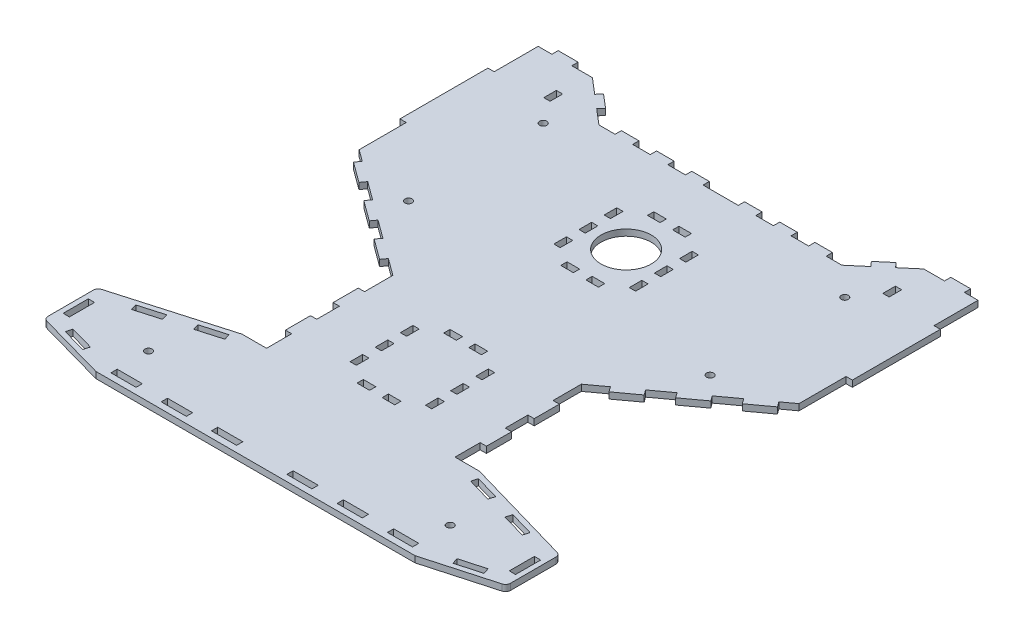
from build123d import *

# Parameters (mm, degrees)
SKETCH1_W           = 2.5
SKETCH1_H           = 10
SKETCH1_W_2         = 10
SKETCH1_H_2         = 2.5
SKETCH1_R           = 1.425
SKETCH1_H_3         = 5
SKETCH1_W_3         = 5
SKETCH1_R_2         = 10
BOSS_EXTRUDE1_DEPTH = 2.5
FILLET2_R           = 2


with BuildPart() as part:
    # Sketch1 → Boss-Extrude1 (new body)
    with BuildSketch(Plane(origin=(0, 0, 0), x_dir=(1, 0, 0), z_dir=(0, 1, 0))):
        Polygon((42.099999999, 82.5), (42.099999999, 85), (35.099999999, 85), (35.099999999, 82.5), (28.099999999, 82.5), (28.099999999, 85), (21.099999999, 85), (21.099999999, 82.5), (14.099999999, 82.5), (14.099999999, 85), (7.099999999, 85), (7.099999999, 82.5), (-6.900000001, 82.5), (-6.900000001, 85), (-13.900000001, 85), (-13.900000001, 82.5), (-20.900000001, 82.5), (-20.900000001, 85), (-27.900000001, 85), (-27.900000001, 82.5), (-34.900000001, 82.5), (-34.900000001, 85), (-41.900000001, 85), (-41.900000001, 82.5), (-48.324658201, 82.5), (-54.391540811, 87.6717252), (-52.769713286, 89.574269675), (-58.096837816, 94.115386744), (-59.718665341, 92.212842269), (-65.92096033, 97.5), (-74.117282979, 97.5), (-74.117282979, 100), (-82.04, 100), (-82.04, 97.5), (-87.5, 97.5), (-87.5, 80), (-90, 80), (-90, 45), (-87.5, 45), (-87.5, 26.268605469), (-82.872162523, 22.882820213), (-84.348313336, 20.865153546), (-76.277646669, 14.960550296), (-74.801495856, 16.978216962), (-67.558072522, 11.678835545), (-69.034223335, 9.661168878), (-60.963556668, 3.756565627), (-59.487405855, 5.774232294), (-52.243982521, 0.474850877), (-53.720133334, -1.54281579), (-45.649466667, -7.447419041), (-44.173315854, -5.429752374), (-37.5, -10.312035847), (-37.5, -21.580641316), (-40, -21.580641316), (-40, -31.580641316), (-37.5, -31.580641316), (-37.5, -40.580641316), (-40, -40.580641316), (-40, -50.580641316), (-37.5, -50.580641316), (-37.5, -60.580641316), (-47.21774937, -60.580641316), (-92, -73.495268006), (-92, -94.516920798), (-63.489002849, -102.5), (63.489002849, -102.5), (92, -94.516920798), (92, -73.495268006), (47.21774937, -60.580641316), (37.5, -60.580641316), (37.5, -50.580641316), (40, -50.580641316), (40, -40.580641316), (37.5, -40.580641316), (37.5, -31.580641316), (40, -31.580641316), (40, -21.580641316), (37.5, -21.580641316), (37.5, -10.312035847), (44.173315854, -5.429752374), (45.649466667, -7.447419041), (53.720133334, -1.54281579), (52.243982521, 0.474850877), (59.487405855, 5.774232294), (60.963556668, 3.756565627), (69.034223335, 9.661168878), (67.558072522, 11.678835545), (74.801495856, 16.978216962), (76.277646669, 14.960550296), (84.348313336, 20.865153546), (82.872162523, 22.882820213), (87.5, 26.268605469), (87.5, 45), (90, 45), (90, 80), (87.5, 80), (87.5, 97.5), (82.1, 97.5), (82.1, 100), (74.177282979, 100), (74.177282979, 97.5), (65.92096033, 97.5), (59.855648543, 92.329613851), (58.233821018, 94.232158326), (52.906696488, 89.691041257), (54.528524013, 87.788496782), (48.324658201, 82.5), align=None)
        Polygon((-72.955536851, -95.176298685), (-73.629611665, -97.583708734), (-83.259251862, -94.887409479), (-82.585177048, -92.479999429), align=None, mode=Mode.SUBTRACT)
        with Locations((-88.75, -84)):
            Rectangle(SKETCH1_W, SKETCH1_H, mode=Mode.SUBTRACT)
        with Locations((-55, -98.75)):
            Rectangle(SKETCH1_W_2, SKETCH1_H_2, mode=Mode.SUBTRACT)
        with Locations(Location((-60, -85, 0), (0, 0, 270))):
            Circle(SKETCH1_R, mode=Mode.SUBTRACT)
        Polygon((-68.82527851, -68.893481916), (-68.132541793, -71.295588459), (-77.740967963, -74.066535325), (-78.43370468, -71.664428783), align=None, mode=Mode.SUBTRACT)
        Polygon((-58.524115623, -68.524641592), (-59.21685234, -66.122535049), (-49.60842617, -63.351588183), (-48.915689453, -65.753694725), align=None, mode=Mode.SUBTRACT)
        with Locations((-35, -98.75)):
            Rectangle(SKETCH1_W_2, SKETCH1_H_2, mode=Mode.SUBTRACT)
        with Locations((-15, -98.75)):
            Rectangle(SKETCH1_W_2, SKETCH1_H_2, mode=Mode.SUBTRACT)
        with Locations((-15, -46.080641316)):
            Rectangle(SKETCH1_W, SKETCH1_H_3, mode=Mode.SUBTRACT)
        with Locations((-5, -53.330641316)):
            Rectangle(SKETCH1_W_3, SKETCH1_H_2, mode=Mode.SUBTRACT)
        with Locations((-15, -36.080641316)):
            Rectangle(SKETCH1_W, SKETCH1_H_3, mode=Mode.SUBTRACT)
        with Locations((-15, -26.080641316)):
            Rectangle(SKETCH1_W, SKETCH1_H_3, mode=Mode.SUBTRACT)
        with Locations((-5, -18.830641316)):
            Rectangle(SKETCH1_W_3, SKETCH1_H_2, mode=Mode.SUBTRACT)
        with Locations((15, -98.75)):
            Rectangle(SKETCH1_W_2, SKETCH1_H_2, mode=Mode.SUBTRACT)
        with Locations((35, -98.75)):
            Rectangle(SKETCH1_W_2, SKETCH1_H_2, mode=Mode.SUBTRACT)
        with Locations((55, -98.75)):
            Rectangle(SKETCH1_W_2, SKETCH1_H_2, mode=Mode.SUBTRACT)
        with Locations(Location((60, -85, 0), (0, 0, 270))):
            Circle(SKETCH1_R, mode=Mode.SUBTRACT)
        Polygon((73.629611665, -97.583708734), (72.955536851, -95.176298685), (82.585177048, -92.479999429), (83.259251862, -94.887409479), align=None, mode=Mode.SUBTRACT)
        with Locations((88.75, -84)):
            Rectangle(SKETCH1_W, SKETCH1_H, mode=Mode.SUBTRACT)
        Polygon((48.915689453, -65.753694725), (49.60842617, -63.351588183), (59.21685234, -66.122535049), (58.524115623, -68.524641592), align=None, mode=Mode.SUBTRACT)
        Polygon((68.132541793, -71.295588459), (68.82527851, -68.893481916), (78.43370468, -71.664428783), (77.740967963, -74.066535325), align=None, mode=Mode.SUBTRACT)
        with Locations((5, -53.330641316)):
            Rectangle(SKETCH1_W_3, SKETCH1_H_2, mode=Mode.SUBTRACT)
        with Locations((15, -46.080641316)):
            Rectangle(SKETCH1_W, SKETCH1_H_3, mode=Mode.SUBTRACT)
        with Locations((15, -36.080641316)):
            Rectangle(SKETCH1_W, SKETCH1_H_3, mode=Mode.SUBTRACT)
        with Locations((5, -18.830641316)):
            Rectangle(SKETCH1_W_3, SKETCH1_H_2, mode=Mode.SUBTRACT)
        with Locations((15, -26.080641316)):
            Rectangle(SKETCH1_W, SKETCH1_H_3, mode=Mode.SUBTRACT)
        with Locations(Location((-60, 18.419358684, 0), (0, 0, 270))):
            Circle(SKETCH1_R, mode=Mode.SUBTRACT)
        with Locations((-5, 27.75)):
            Rectangle(SKETCH1_W_3, SKETCH1_H_2, mode=Mode.SUBTRACT)
        with Locations((-15, 35)):
            Rectangle(SKETCH1_W, SKETCH1_H_3, mode=Mode.SUBTRACT)
        with Locations(Location((-60, 72, 0), (0, 0, 270))):
            Circle(SKETCH1_R, mode=Mode.SUBTRACT)
        with Locations((-67.45, 83.43)):
            Rectangle(SKETCH1_W, SKETCH1_H_3, mode=Mode.SUBTRACT)
        with Locations((-15, 45)):
            Rectangle(SKETCH1_W, SKETCH1_H_3, mode=Mode.SUBTRACT)
        with Locations(Location((0, 45, 0), (0, 0, 270))):
            Circle(SKETCH1_R_2, mode=Mode.SUBTRACT)
        with Locations((-15, 55)):
            Rectangle(SKETCH1_W, SKETCH1_H_3, mode=Mode.SUBTRACT)
        with Locations((-5, 62.25)):
            Rectangle(SKETCH1_W_3, SKETCH1_H_2, mode=Mode.SUBTRACT)
        with Locations((5, 27.75)):
            Rectangle(SKETCH1_W_3, SKETCH1_H_2, mode=Mode.SUBTRACT)
        with Locations((15, 35)):
            Rectangle(SKETCH1_W, SKETCH1_H_3, mode=Mode.SUBTRACT)
        with Locations(Location((60, 18.419358684, 0), (0, 0, 270))):
            Circle(SKETCH1_R, mode=Mode.SUBTRACT)
        with Locations((15, 45)):
            Rectangle(SKETCH1_W, SKETCH1_H_3, mode=Mode.SUBTRACT)
        with Locations((5, 62.25)):
            Rectangle(SKETCH1_W_3, SKETCH1_H_2, mode=Mode.SUBTRACT)
        with Locations((15, 55)):
            Rectangle(SKETCH1_W, SKETCH1_H_3, mode=Mode.SUBTRACT)
        with Locations(Location((60, 72, 0), (0, 0, 270))):
            Circle(SKETCH1_R, mode=Mode.SUBTRACT)
        with Locations((67.45, 83.43)):
            Rectangle(SKETCH1_W, SKETCH1_H_3, mode=Mode.SUBTRACT)
    extrude(amount=BOSS_EXTRUDE1_DEPTH)

    # Fillet2
    fillet2_edges = [part.edges().sort_by_distance(p)[0] for p in [
        (92, 1.25, 73.495268006),
        (92, 1.25, 94.516920798),
        (-92, 1.25, 94.516920798),
        (-92, 1.25, 73.495268006),
    ]]
    fillet(fillet2_edges, radius=FILLET2_R)


solid = part.part
